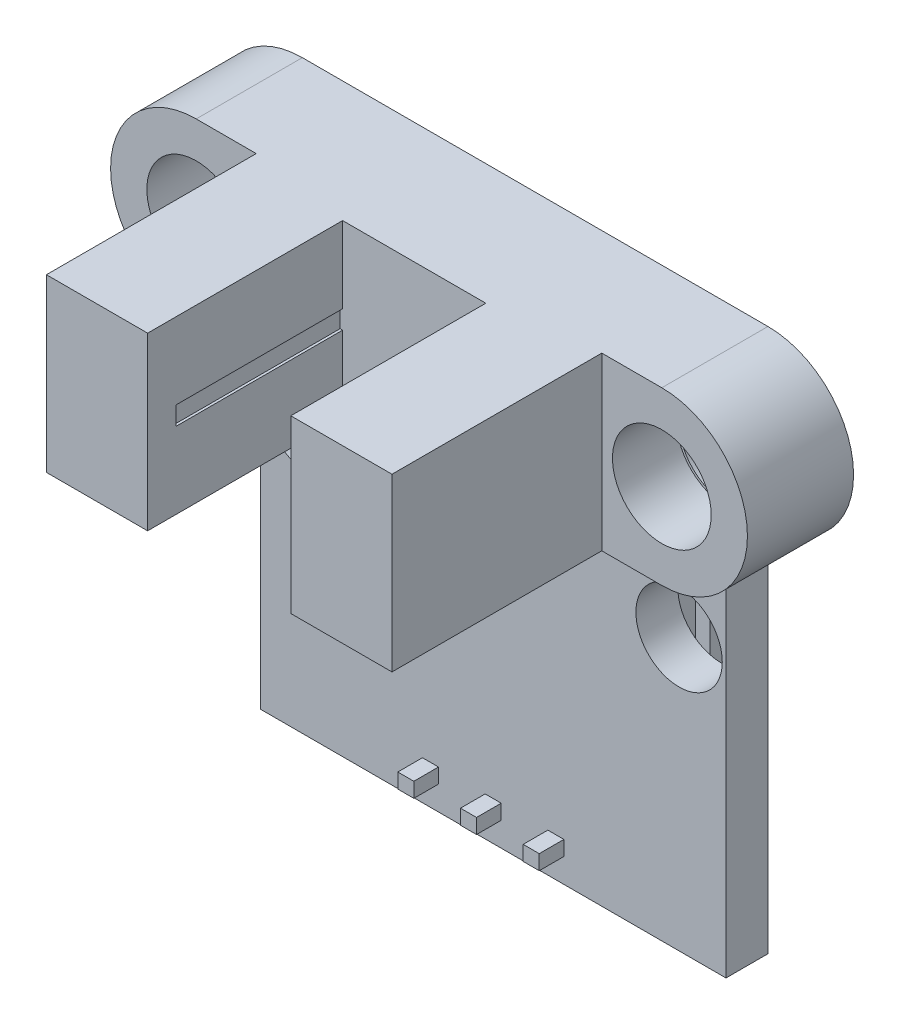
from build123d import *

# Parameters (mm, degrees)
IZIM1_R                     = 1.900647948
IZIM1_R_2                   = 1.75
Y_KSEKLIK_EKSTR_ZYON1_DEPTH = 1.7
IZIM2_R                     = 2
Y_KSEKLIK_EKSTR_ZYON2_DEPTH = 2.6
IZIM3_W                     = 4.100055298
IZIM3_H                     = 6.937365011
Y_KSEKLIK_EKSTR_ZYON3_DEPTH = 8.5
IZIM4_W                     = 5.8
IZIM4_H                     = 6.937365011
Y_KSEKLIK_EKSTR_ZYON4_DEPTH = 0.6
Y_KSEKLIK_EKSTR_ZYON6_DEPTH = 2.54
IZIM6_W                     = 18.863930886
IZIM6_H                     = 1.7
Y_KSEKLIK_EKSTR_ZYON7_DEPTH = 0.01
KES_EKSTR_ZYON1_DEPTH       = 5.9
KES_EKSTR_ZYON1_DEPTH_BACK  = 0.1
IZIM7_W                     = 6.75
IZIM7_H                     = 0.75
IZIM8_W                     = 0.664910116
IZIM8_H                     = 0.664910116
IZIM11_W                    = 0.65
IZIM11_H                    = 0.6
Y_KSEKLIK_EKSTR_ZYON8_DEPTH = 1
Y_KSEKLIK_EKSTR_ZYON9_DEPTH = 1.5


with BuildPart() as part:
    # Çizim1 → Yükseklik-Ekstrüzyon1 (new body)
    with BuildSketch(Plane.XY):
        with BuildLine():
            Line((-9.431965443, -11), (9.431965443, -11))
            Line((9.431965443, -11), (9.431965443, 4.062634989))
            ThreePointArc((9.431965443, 4.062634989), (12.900647948, 7.531317495), (9.431965443, 11))
            Line((9.431965443, 11), (-9.431965443, 11))
            ThreePointArc((-9.431965443, 11), (-12.900647948, 7.531317495), (-9.431965443, 4.062634989))
            Line((-9.431965443, 4.062634989), (-9.431965443, -11))
        make_face()
        with Locations((9.431965443, 7.531317495)):
            Circle(IZIM1_R, mode=Mode.SUBTRACT)
        with Locations(Location((-9.431965443, 7.531317495, 0), (0, 0, 180))):
            Circle(IZIM1_R, mode=Mode.SUBTRACT)
        with Locations((7.531317495, 0)):
            Circle(IZIM1_R_2, mode=Mode.SUBTRACT)
        with Locations(Location((-7.531317495, 0, 0), (0, 0, 180))):
            Circle(IZIM1_R_2, mode=Mode.SUBTRACT)
    extrude(amount=Y_KSEKLIK_EKSTR_ZYON1_DEPTH)

    # Çizim2 → Yükseklik-Ekstrüzyon2 (add)
    with BuildSketch(Plane.XY.offset(1.7)):
        with BuildLine():
            Line((-9.431965443, 11), (9.431965443, 11))
            ThreePointArc((9.431965443, 11), (12.900647948, 7.531317495), (9.431965443, 4.062634989))
            Line((9.431965443, 4.062634989), (-9.431965443, 4.062634989))
            ThreePointArc((-9.431965443, 4.062634989), (-12.900647948, 7.531317495), (-9.431965443, 11))
        make_face()
        with Locations((-9.431965443, 7.531317495)):
            Circle(IZIM2_R, mode=Mode.SUBTRACT)
        with Locations((9.431965443, 7.531317495)):
            Circle(IZIM2_R, mode=Mode.SUBTRACT)
    extrude(amount=Y_KSEKLIK_EKSTR_ZYON2_DEPTH)

    # Çizim3 → Yükseklik-Ekstrüzyon3 (add)
    with BuildSketch(Plane.XY.offset(4.3)):
        with Locations((4.950027649, 7.531317494)):
            Rectangle(IZIM3_W, IZIM3_H)
        with Locations((-4.950027649, 7.531317494)):
            Rectangle(IZIM3_W, IZIM3_H)
    extrude(amount=Y_KSEKLIK_EKSTR_ZYON3_DEPTH)

    # Çizim4 → Yükseklik-Ekstrüzyon4 (add)
    with BuildSketch(Plane.XY.offset(4.3)):
        with Locations((0, 7.531317494)):
            Rectangle(IZIM4_W, IZIM4_H)
    extrude(amount=Y_KSEKLIK_EKSTR_ZYON4_DEPTH)

    # Çizim5 → Yükseklik-Ekstrüzyon6 (add)
    with BuildSketch(Plane(origin=(0, 0, 0), x_dir=(-1, 0, 0), z_dir=(0, 0, -1))):
        Polygon((-1.27, -10.75), (-1.27, -8.71), (-1.52, -8.46), (-3.56, -8.46), (-3.81, -8.71), (-3.81, -10.75), (-3.56, -11), (-1.52, -11), align=None)
        Polygon((1.27, -8.71), (1.02, -8.46), (-1.02, -8.46), (-1.27, -8.71), (-1.27, -10.75), (-1.02, -11), (1.02, -11), (1.27, -10.75), align=None)
        Polygon((1.52, -8.46), (1.27, -8.71), (1.27, -10.75), (1.52, -11), (3.56, -11), (3.81, -10.75), (3.81, -8.71), (3.56, -8.46), align=None)
    extrude(amount=Y_KSEKLIK_EKSTR_ZYON6_DEPTH)

    # Çizim6 → Yükseklik-Ekstrüzyon7 (add)
    with BuildSketch(Plane.XZ.offset(11)):
        with Locations((0, 0.85)):
            Rectangle(IZIM6_W, IZIM6_H)
    extrude(amount=Y_KSEKLIK_EKSTR_ZYON7_DEPTH)

    # Çizim7 → Kes-Ekstrüzyon1 (cut, two sides: drawn at the far end of the back side and taken through both)
    with BuildSketch(Plane.ZY.offset(-2.9).offset(-KES_EKSTR_ZYON1_DEPTH_BACK)):
        with Locations((8.275, 7.531317495)):
            Rectangle(IZIM7_W, IZIM7_H)
    extrude(amount=KES_EKSTR_ZYON1_DEPTH + KES_EKSTR_ZYON1_DEPTH_BACK, mode=Mode.SUBTRACT)

    # Süpür1: sweep along a path in Çizim9
    with BuildLine(Plane(origin=(0, 0, 0), x_dir=(0, 0, -1), z_dir=(1, 0, 0))) as s_p_r1_path:
        Line((2.54, -9.73), (4.04, -9.73))
        ThreePointArc((4.04, -9.73), (4.393553391, -9.583553391), (4.54, -9.23))
        Line((4.54, -9.23), (4.54, -3.305))
    # Çizim8 → Süpür1 (sweep)
    with BuildSketch(Plane(origin=(0, 0, -2.54), x_dir=(-1, 0, 0), z_dir=(0, 0, -1))):
        with Locations((2.54, -9.73)):
            Rectangle(IZIM8_W, IZIM8_H)
        with Locations((0, -9.73)):
            Rectangle(IZIM8_W, IZIM8_H)
        with Locations((-2.54, -9.73)):
            Rectangle(IZIM8_W, IZIM8_H)
    sweep(path=s_p_r1_path.line)

    # Çizim11 → Yükseklik-Ekstrüzyon8 (add)
    with BuildSketch(Plane.XY.offset(1.7)):
        with Locations((-2.54, -9.73)):
            Rectangle(IZIM11_W, IZIM11_H)
        with Locations((0, -9.73)):
            Rectangle(IZIM11_W, IZIM11_H)
        with Locations((2.54, -9.73)):
            Rectangle(IZIM11_W, IZIM11_H)
    extrude(amount=Y_KSEKLIK_EKSTR_ZYON8_DEPTH)

    # Çizim12 → Yükseklik-Ekstrüzyon9 (add)
    with BuildSketch(Plane(origin=(0, 0, 0), x_dir=(-1, 0, 0), z_dir=(0, 0, -1))):
        Polygon((-4.998159683, 0), (-4.998159683, 2.331223734), (-1.20341454, 2.331223734), (-1.20341454, -3.045965908), (-4.998159683, -3.045965908), align=None)
    extrude(amount=Y_KSEKLIK_EKSTR_ZYON9_DEPTH)


solid = part.part
